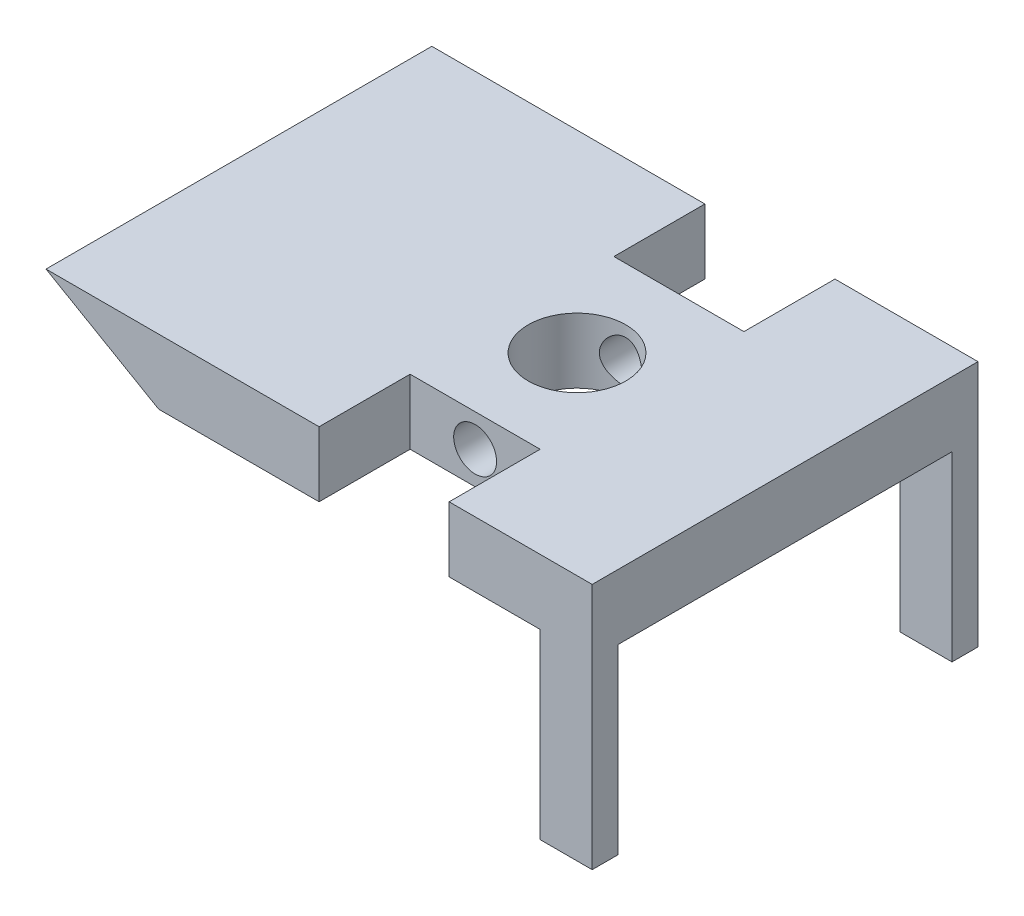
from build123d import *

# Parameters (mm, degrees)
BOSS_EXTRUDE1_DEPTH = 14.835
CUT_EXTRUDE1_REACH  = 38.436
SKETCH4_R           = 1.65
SKETCH4_3_W         = 10
SKETCH4_3_H         = 5
SKETCH4_3_R         = 1.65
CUT_EXTRUDE3_DEPTH  = 7
CUT_EXTRUDE2_REACH  = 28.193
SKETCH5_R           = 3.75
SKETCH6_W           = 4
SKETCH6_H           = 14
BOSS_EXTRUDE2_DEPTH = 29.67
SKETCH7_W           = 25.67
SKETCH7_H           = 14
CUT_EXTRUDE4_DEPTH  = 10


with BuildPart() as part:
    # Sketch3 → Boss-Extrude1 (new, symmetric)
    with BuildSketch(Plane.XY):
        Polygon((-21, 2.5), (-12.339745962, -2.5), (21, -2.5), (21, 2.5), align=None)
    extrude(amount=BOSS_EXTRUDE1_DEPTH, both=True)

    # Sketch4 → Cut-Extrude1 (cut, up to next)
    with BuildSketch(Plane.XY.offset(14.835), mode=Mode.PRIVATE) as cut_extrude1_sk1:
        with Locations((5, 0)):
            Circle(SKETCH4_R)
    cut_extrude1_tool1 = extrude(cut_extrude1_sk1.sketch, amount=-CUT_EXTRUDE1_REACH, mode=Mode.PRIVATE) & part.part
    add(cut_extrude1_tool1.solids().sort_by_distance((5, 0, 14.835))[0], mode=Mode.SUBTRACT)

    # Sketch4<3> → Cut-Extrude3 (cut)
    with BuildSketch(Plane.XY.offset(14.835)):
        with Locations((5, 0)):
            Rectangle(SKETCH4_3_W, SKETCH4_3_H)
        with Locations((5, 0)):
            Circle(SKETCH4_3_R, mode=Mode.SUBTRACT)
    cut_extrude3 = extrude(amount=-CUT_EXTRUDE3_DEPTH, mode=Mode.SUBTRACT)

    # Mirror1: Cut-Extrude3 across plane
    add(cut_extrude3.mirror(Plane.XY), mode=Mode.SUBTRACT)

    # Sketch5 → Cut-Extrude2 (cut, up to next)
    with BuildSketch(Plane(origin=(0, 2.5, 0), x_dir=(1, 0, 0), z_dir=(0, 1, 0)), mode=Mode.PRIVATE) as cut_extrude2_sk1:
        with Locations(Location((5, 0, 0), (0, 0, 270))):
            Circle(SKETCH5_R)
    cut_extrude2_tool1 = extrude(cut_extrude2_sk1.sketch, amount=-CUT_EXTRUDE2_REACH, mode=Mode.PRIVATE) & part.part
    add(cut_extrude2_tool1.solids().sort_by_distance((5, 2.5, 0))[0], mode=Mode.SUBTRACT)

    # Sketch6 → Boss-Extrude2 (add)
    with BuildSketch(Plane.XY.offset(14.835)):
        with Locations((19, -9.5)):
            Rectangle(SKETCH6_W, SKETCH6_H)
    extrude(amount=-BOSS_EXTRUDE2_DEPTH)

    # Sketch7 → Cut-Extrude4 (cut)
    with BuildSketch(Plane(origin=(21, 0, 0), x_dir=(0, 0, -1), z_dir=(1, 0, 0))):
        with Locations((0, -9.5)):
            Rectangle(SKETCH7_W, SKETCH7_H)
    extrude(amount=-CUT_EXTRUDE4_DEPTH, mode=Mode.SUBTRACT)


solid = part.part
